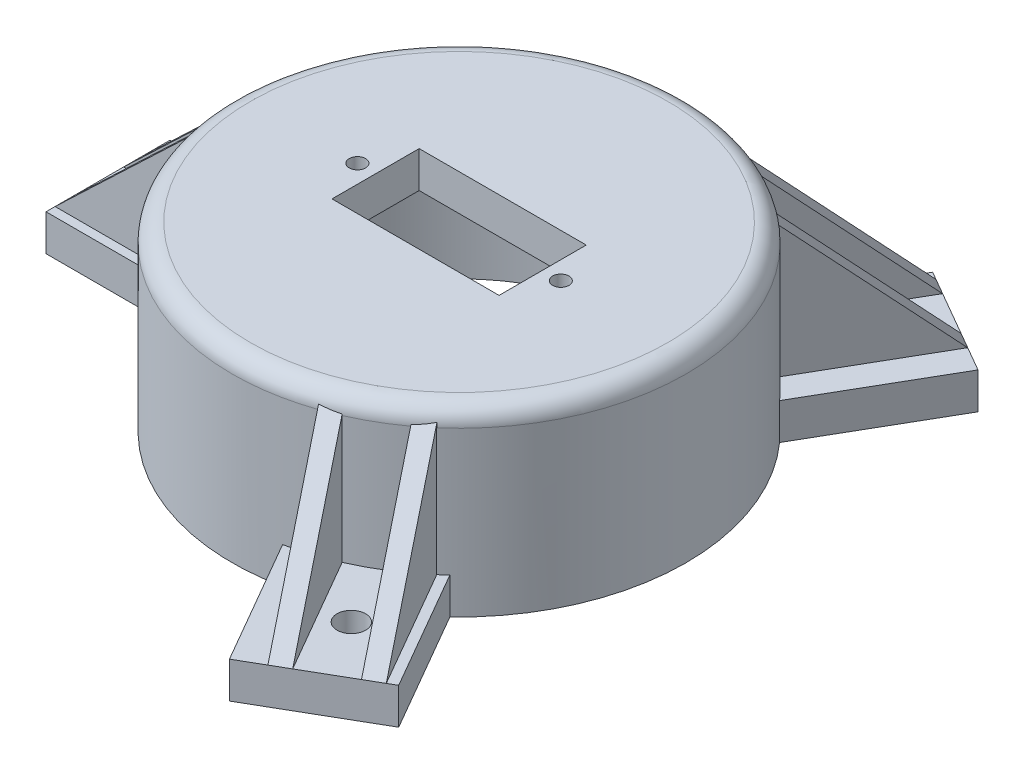
from build123d import *

# Parameters (mm, degrees)
SKETCH1_R                   = 31.75
BOSS_EXTRUDE1_DEPTH         = 25.4
FILLET1_R                   = 2.54
SKETCH2_R                   = 26.178994306
CUT_EXTRUDE1_DEPTH          = 20.32
SKETCH3_W                   = 23.368
SKETCH3_H                   = 12.192
CUT_EXTRUDE2_DEPTH          = 20.32
SKETCH4_R                   = 1.143
CUT_EXTRUDE3_DEPTH          = 20.32
SKETCH6_W                   = 22.454622086
SKETCH6_H                   = 17.327996038
BOSS_EXTRUDE2_DEPTH         = 5.08
RIB1_REACH                  = 69.27
SKETCH11_WALL_W             = 162.351686776
SKETCH11_WALL_H             = 2.54
CIRPATTERN1_COUNT           = 3
CIRPATTERN1_COPY_1_REACH    = 69.27
CIRPATTERN1_COPY_1_SKETCH_W = 162.351686776
CIRPATTERN1_COPY_1_SKETCH_H = 2.54
CIRPATTERN1_COPY_2_REACH    = 69.27
CIRPATTERN1_COPY_2_SKETCH_W = 162.351686776
CIRPATTERN1_COPY_2_SKETCH_H = 2.54
SKETCH12_R                  = 2
CUT_EXTRUDE4_DEPTH          = 5.08
CIRPATTERN2_COUNT           = 3


with BuildPart() as part:
    # Sketch1 → Boss-Extrude1 (new body)
    with BuildSketch(Plane(origin=(0, 0, 0), x_dir=(1, 0, 0), z_dir=(0, 1, 0))):
        with Locations(Location((0, 0, 0), (0, 0, 270))):
            Circle(SKETCH1_R)
    extrude(amount=BOSS_EXTRUDE1_DEPTH)

    # Fillet1
    fillet1_edges = [part.edges().sort_by_distance(p)[0] for p in [
        (0, 25.4, -31.75),
    ]]
    fillet(fillet1_edges, radius=FILLET1_R)

    # Sketch2 → Cut-Extrude1 (cut)
    with BuildSketch(Plane.XZ):
        with Locations(Location((0, 0, 0), (0, 0, 270))):
            Circle(SKETCH2_R)
    extrude(amount=-CUT_EXTRUDE1_DEPTH, mode=Mode.SUBTRACT)

    # Sketch3 → Cut-Extrude2 (cut)
    with BuildSketch(Plane(origin=(0, 25.4, 0), x_dir=(1, 0, 0), z_dir=(0, 1, 0))):
        Rectangle(SKETCH3_W, SKETCH3_H)
    extrude(amount=-CUT_EXTRUDE2_DEPTH, mode=Mode.SUBTRACT)

    # Sketch4 → Cut-Extrude3 (cut)
    with BuildSketch(Plane(origin=(0, 25.4, 0), x_dir=(1, 0, 0), z_dir=(0, 1, 0))):
        with Locations(Location((-14.224, 0, 0), (0, 0, 270))):
            Circle(SKETCH4_R)
    cut_extrude3 = extrude(amount=-CUT_EXTRUDE3_DEPTH, mode=Mode.SUBTRACT)

    # Mirror1: Cut-Extrude3 across plane
    add(cut_extrude3.mirror(Plane(origin=(0, 0, 0), x_dir=(0, 0, 1), z_dir=(1, 0, 0))), mode=Mode.SUBTRACT)

    # Sketch6 → Boss-Extrude2 (add)
    with BuildSketch(Plane.XZ):
        with Locations((-39.218689259, -1.332922772)):
            Rectangle(SKETCH6_W, SKETCH6_H)
    boss_extrude2 = extrude(amount=-BOSS_EXTRUDE2_DEPTH)

    # Sketch11 wall → Rib1 (add, up to next)
    with BuildSketch(Plane(origin=(-41.089874413, 13.97, 4.791075247), x_dir=(0.724934415066, 0.688817896002, 0), z_dir=(-0.688817896002, 0.724934415066, 0)), mode=Mode.PRIVATE) as rib1_sk1:
        Rectangle(SKETCH11_WALL_W, SKETCH11_WALL_H)
    rib1_tool1 = extrude(rib1_sk1.sketch, amount=-RIB1_REACH, mode=Mode.PRIVATE) - part.part
    rib1 = rib1_tool1.solids().sort_by_distance((-41.089874413, 13.97, 4.791075247))[0]
    add(rib1)

    # Mirror2: Rib1 across plane
    add(rib1.mirror(Plane.XY))

    # CirPattern1: Boss-Extrude2, Rib1 ×3 about axis
    cirpattern1_axis = Axis((0, 0, 0), (0, 1, 0))
    add([boss_extrude2.rotate(cirpattern1_axis, i * 360 / CIRPATTERN1_COUNT) for i in range(1, CIRPATTERN1_COUNT)])
    add([rib1.rotate(cirpattern1_axis, i * 360 / CIRPATTERN1_COUNT) for i in range(1, CIRPATTERN1_COUNT)])

    # CirPattern1 copy 1 sketch → CirPattern1 copy 1 (add, up to next)
    with BuildSketch(Plane(origin=(16.395744331, 13.97, 37.980412703), x_dir=(-0.3624672075329998, 0.688817896002, -0.6278116195247685), z_dir=(0.34440894800099986, 0.724934415066, 0.5965337965190796)), mode=Mode.PRIVATE) as cirpattern1_copy_1_sk1:
        Rectangle(CIRPATTERN1_COPY_1_SKETCH_W, CIRPATTERN1_COPY_1_SKETCH_H)
    cirpattern1_copy_1_tool1 = extrude(cirpattern1_copy_1_sk1.sketch, amount=-CIRPATTERN1_COPY_1_REACH, mode=Mode.PRIVATE) - part.part
    add(cirpattern1_copy_1_tool1.solids().sort_by_distance((16.395744331, 13.97, 37.980412703))[0])

    # CirPattern1 copy 2 sketch → CirPattern1 copy 2 (add, up to next)
    with BuildSketch(Plane(origin=(24.694130082, 13.97, -33.189337456), x_dir=(-0.3624672075330003, 0.688817896002, 0.6278116195247683), z_dir=(0.34440894800100036, 0.724934415066, -0.5965337965190793)), mode=Mode.PRIVATE) as cirpattern1_copy_2_sk1:
        Rectangle(CIRPATTERN1_COPY_2_SKETCH_W, CIRPATTERN1_COPY_2_SKETCH_H)
    cirpattern1_copy_2_tool1 = extrude(cirpattern1_copy_2_sk1.sketch, amount=-CIRPATTERN1_COPY_2_REACH, mode=Mode.PRIVATE) - part.part
    add(cirpattern1_copy_2_tool1.solids().sort_by_distance((24.694130082, 13.97, -33.189337456))[0])

    # Sketch12 → Cut-Extrude4 (cut)
    with BuildSketch(Plane(origin=(0, 5.08, 0), x_dir=(1, 0, 0), z_dir=(0, 1, 0))):
        with Locations(Location((-41.1817754, 0, 0), (0, 0, 270))):
            Circle(SKETCH12_R)
    cut_extrude4 = extrude(amount=-CUT_EXTRUDE4_DEPTH, mode=Mode.SUBTRACT)

    # CirPattern2: Cut-Extrude4 ×3 about axis
    cirpattern2_axis = Axis((0, 0, 0), (0, 1, 0))
    for i in range(1, CIRPATTERN2_COUNT):
        add(cut_extrude4.rotate(cirpattern2_axis, i * 360 / CIRPATTERN2_COUNT), mode=Mode.SUBTRACT)


solid = part.part
